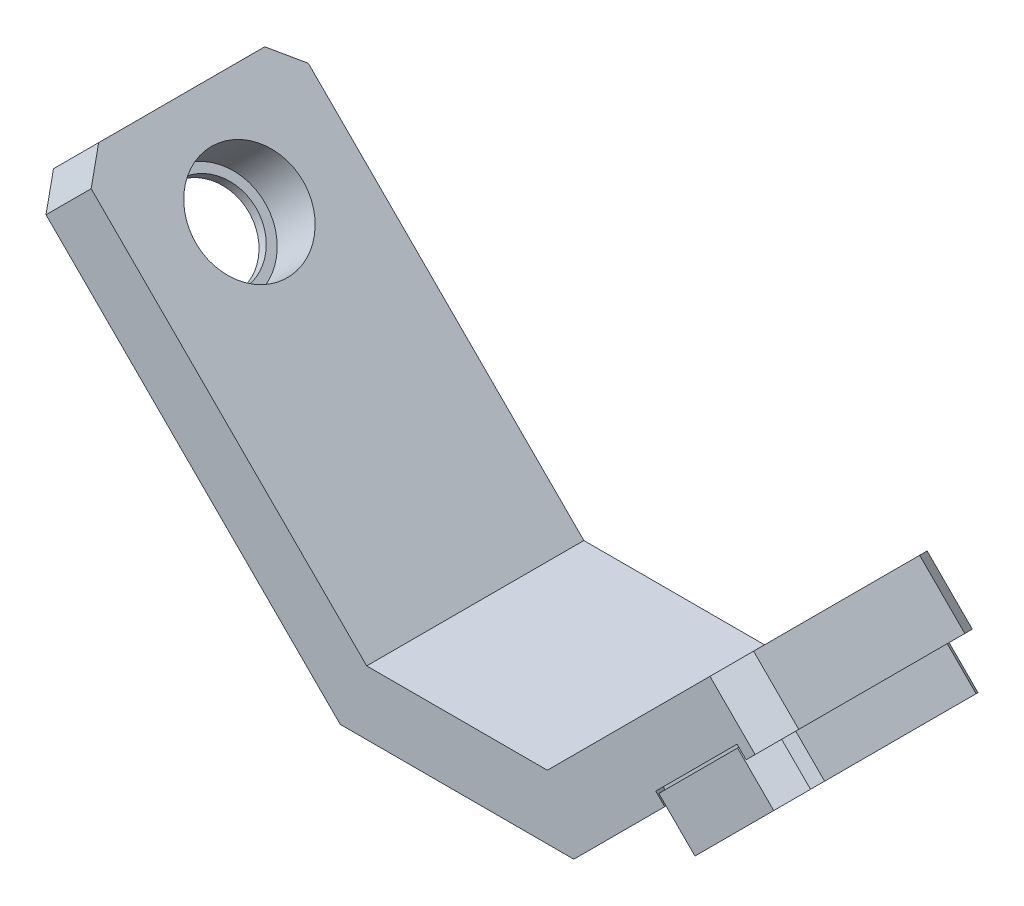
from build123d import *

# Parameters (mm, degrees)
EXTRUDE_1_DEPTH     = 8.5
CUT_EXTRUDE_START   = -5
SKETCH_2_R          = 4.2
CUT_EXTRUDE_1_DEPTH = 4.2
CUT_EXTRUDE_2_DEPTH = 1
SKETCH_5_R          = 1.9
CUT_EXTRUDE_5_DEPTH = 50.794578018
CHAMFER_1_SIZE      = 2
EXTRUDE_START       = 0.2
SKETCH_6_R          = 1.9
EXTRUDE_2_DEPTH     = 4
CUT_EXTRUDE_6_DEPTH = 3.4
SKETCH_9_R          = 1.4
CUT_EXTRUDE_7_DEPTH = 54.932735885
CUT_EXTRUDE_8_DEPTH = 54.932735885
CHAMFER_3_SIZE      = 0.5
SKETCH_11_R         = 3.5
CUT_EXTRUDE_9_DEPTH = 10


with BuildPart() as part:
    # ｽｹｯﾁ1 → ﾎﾞｽ - 押し出し1 (new, symmetric)
    with BuildSketch(Plane.XY):
        Polygon((0, 0), (-24.445436483, 24.445436483), (-20.909902577, 27.980970389), (2.071067812, 5), (16.213203436, 5), (30.355339059, 19.142135624), (33.890872965, 15.606601718), (18.284271247, 0), align=None)
    extrude(amount=EXTRUDE_1_DEPTH, both=True)

    # ｽｹｯﾁ2 → ｶｯﾄ - 押し出し1 (cut)
    with BuildSketch(Plane(origin=(0, 0, 0), x_dir=(0, 0, 1), z_dir=(-0.7071067811865487, -0.7071067811865464, 0)).offset(CUT_EXTRUDE_START)):
        with Locations(Location((0, 27.071067812, 0), (0, 0, 90))):
            Circle(SKETCH_2_R)
    extrude(amount=CUT_EXTRUDE_1_DEPTH, mode=Mode.SUBTRACT)

    # ｽｹｯﾁ3 → ｶｯﾄ - 押し出し2 (cut)
    with BuildSketch(Plane(origin=(9.142135624, -9.142135624, 0), x_dir=(0, 0, -1), z_dir=(0.7071067811865485, -0.7071067811865467, 0))):
        Polygon((-6.5, 21), (6.5, 21), (6.5, 34), (-6.5, 34), (-13, 27.5), align=None)
    extrude(amount=-CUT_EXTRUDE_2_DEPTH, mode=Mode.SUBTRACT)

    # ｽｹｯﾁ5 → ｶｯﾄ - 押し出し5 (cut, through all)
    with BuildSketch(Plane(origin=(8.435028843, -8.435028843, 0), x_dir=(0, 0, -1), z_dir=(0.7071067811865483, -0.7071067811865468, 0))):
        with Locations(Location((0, 27.5, 0), (0, 0, 90))):
            Circle(SKETCH_5_R)
    extrude(amount=-CUT_EXTRUDE_5_DEPTH, mode=Mode.SUBTRACT)

    # 面取り1
    chamfer_1_edges = [part.edges().sort_by_distance(p)[0] for p in [
        (32.123106012, 17.374368671, -8.5),
        (32.123106012, 17.374368671, 8.5),
        (-22.67766953, 26.213203436, 8.5),
        (-22.67766953, 26.213203436, -8.5),
    ]]
    chamfer(chamfer_1_edges, length=CHAMFER_1_SIZE)

    # ｽｹｯﾁ9 → ｶｯﾄ - 押し出し7 (cut, through all)
    with BuildSketch(Plane(origin=(11.404877324, -11.404877324, 0), x_dir=(0, 0, -1), z_dir=(0.7071067811865489, -0.7071067811865462, 0))):
        with Locations(Location((4, 23.5, 0), (0, 0, 90))):
            Circle(SKETCH_9_R)
        with Locations(Location((4, 31.5, 0), (0, 0, 90))):
            Circle(SKETCH_9_R)
        with Locations(Location((-6, 27.5, 0), (0, 0, 90))):
            Circle(SKETCH_9_R)
    extrude(amount=-CUT_EXTRUDE_7_DEPTH, mode=Mode.SUBTRACT)

    # ｽｹｯﾁ11 → ｶｯﾄ - 押し出し9 (cut)
    with BuildSketch(Plane(origin=(0.565685425, 0.565685425, 0), x_dir=(0, 0, 1), z_dir=(-0.7071067811865487, -0.7071067811865464, 0))):
        with Locations(Location((0, 27.071067812, 0), (0, 0, 90))):
            Circle(SKETCH_11_R)
    extrude(amount=CUT_EXTRUDE_9_DEPTH, mode=Mode.SUBTRACT)


with BuildPart() as body_2:
    # ｽｹｯﾁ6 → ﾎﾞｽ - 押し出し2 (new body)
    with BuildSketch(Plane(origin=(8.435028843, -8.435028843, 0), x_dir=(0, 0, -1), z_dir=(0.7071067811865483, -0.7071067811865468, 0)).offset(EXTRUDE_START)):
        Polygon((-8.5, 23.141421356), (-8.5, 31.858578644), (-6.458578644, 33.9), (6.4, 33.9), (6.4, 21.1), (-6.458578644, 21.1), align=None)
        with Locations(Location((0, 27.5, 0), (0, 0, 90))):
            Circle(SKETCH_6_R, mode=Mode.SUBTRACT)
    extrude(amount=EXTRUDE_2_DEPTH)

    # ｽｹｯﾁ7 → ｶｯﾄ - 押し出し6 (cut)
    with BuildSketch(Plane(origin=(11.404877324, -11.404877324, 0), x_dir=(0, 0, -1), z_dir=(0.7071067811865479, -0.7071067811865471, 0))):
        Polygon((-2.637485906, 27.137485906), (-2.95, 27.45), (-3.95, 27.45), (-3.95, 27.55), (-2.95, 27.55), (-2.637485906, 27.862514094), (-2.854095836, 28.247754611), (-3.817013124, 28.517551382), (-3.790033446, 28.61384311), (-2.827116159, 28.344046339), (-2.441875642, 28.560656269), (-2.546516441, 28.990051682), (-3.400935845, 29.509635632), (-3.34897745, 29.595077573), (-2.494558046, 29.075493623), (-2.065162633, 29.180134421), (-2.050073571, 29.621838437), (-2.732626714, 30.352674402), (-2.659543117, 30.420929716), (-1.976989974, 29.690093752), (-1.535285958, 29.67500469), (-1.401586122, 30.096258142), (-1.86165116, 30.984143361), (-1.772862638, 31.030149865), (-1.3127976, 30.142264646), (-0.891544148, 30.00856481), (-0.649149443, 30.378125258), (-0.852605456, 31.357209346), (-0.754697047, 31.377554947), (-0.551241034, 30.398470859), (-0.181680586, 30.156076155), (0.151431681, 30.44653499), (0.219674094, 31.444203759), (0.319440971, 31.437379518), (0.251198558, 30.439710748), (0.541657393, 30.106598481), (0.94078181, 30.296413701), (1.275661422, 31.238674623), (1.369887514, 31.205186662), (1.035007902, 30.26292574), (1.224823122, 29.863801323), (1.660358456, 29.9388952), (2.237038778, 30.755865093), (2.318735767, 30.698197061), (1.742055445, 29.881227168), (1.817149322, 29.445691834), (2.25679391, 29.400495), (3.032505201, 30.031582945), (3.095613995, 29.954011816), (2.319902705, 29.322923871), (2.274705871, 28.883279283), (2.685853285, 28.72114378), (3.603064586, 29.11954487), (3.642904695, 29.02782374), (2.725693394, 28.62942265), (2.563557891, 28.218275236), (2.915715208, 27.951225912), (3.906401154, 28.087392561), (3.920017819, 27.988323967), (2.929331873, 27.852157318), (2.66228255, 27.5), (2.929331873, 27.147842682), (3.920017819, 27.011676033), (3.906401154, 26.912607439), (2.915715208, 27.048774088), (2.563557891, 26.781724764), (2.725693394, 26.37057735), (3.642904695, 25.97217626), (3.603064586, 25.88045513), (2.685853285, 26.27885622), (2.274705871, 26.116720717), (2.319902705, 25.677076129), (3.095613995, 25.045988184), (3.032505201, 24.968417055), (2.25679391, 25.599505), (1.817149322, 25.554308166), (1.742055445, 25.118772832), (2.318735767, 24.301802939), (2.237038778, 24.244134907), (1.660358456, 25.0611048), (1.224823122, 25.136198677), (1.035007902, 24.73707426), (1.369887514, 23.794813338), (1.275661422, 23.761325377), (0.94078181, 24.703586299), (0.541657393, 24.893401519), (0.251198558, 24.560289252), (0.319440971, 23.562620482), (0.219674094, 23.555796241), (0.151431681, 24.55346501), (-0.181680586, 24.843923845), (-0.551241034, 24.601529141), (-0.754697047, 23.622445053), (-0.852605456, 23.642790654), (-0.649149443, 24.621874742), (-0.891544148, 24.99143519), (-1.3127976, 24.857735354), (-1.772862638, 23.969850135), (-1.86165116, 24.015856639), (-1.401586122, 24.903741858), (-1.535285958, 25.32499531), (-1.976989974, 25.309906248), (-2.659543117, 24.579070284), (-2.732626714, 24.647325598), (-2.050073571, 25.378161563), (-2.065162633, 25.819865579), (-2.494558046, 25.924506377), (-3.34897745, 25.404922427), (-3.400935845, 25.490364368), (-2.546516441, 26.009948318), (-2.441875642, 26.439343731), (-2.827116159, 26.655953661), (-3.790033446, 26.38615689), (-3.817013124, 26.482448618), (-2.854095836, 26.752245389), align=None)
    extrude(amount=-CUT_EXTRUDE_6_DEPTH, mode=Mode.SUBTRACT)

    # ｽｹｯﾁ10 → ｶｯﾄ - 押し出し8 (cut, through all)
    with BuildSketch(Plane(origin=(11.404877324, -11.404877324, 0), x_dir=(0, 0, -1), z_dir=(0.707106781186549, -0.707106781186546, 1.1934897514720433e-15))):
        Polygon((3.1, 23.5), (3.55, 22.720577137), (4.45, 22.720577137), (4.9, 23.5), (4.45, 24.279422863), (3.55, 24.279422863), align=None)
        Polygon((3.1, 31.5), (3.55, 30.720577137), (4.45, 30.720577137), (4.9, 31.5), (4.45, 32.279422863), (3.55, 32.279422863), align=None)
        Polygon((-6.9, 27.5), (-6.45, 26.720577137), (-5.55, 26.720577137), (-5.1, 27.5), (-5.55, 28.279422863), (-6.45, 28.279422863), align=None)
    extrude(amount=-CUT_EXTRUDE_8_DEPTH, mode=Mode.SUBTRACT)

    # 面取り3
    chamfer_3_edges = [body_2.edges().sort_by_distance(p)[0] for p in [
        (33.961583643, 13.980256121, 6.458578644),
        (33.961583643, 13.980256121, -6.4),
        (24.910616844, 4.929289322, -6.4),
        (24.910616844, 4.929289322, 6.458578644),
    ]]
    chamfer(chamfer_3_edges, length=CHAMFER_3_SIZE)


solid = Compound([part.part, body_2.part])
